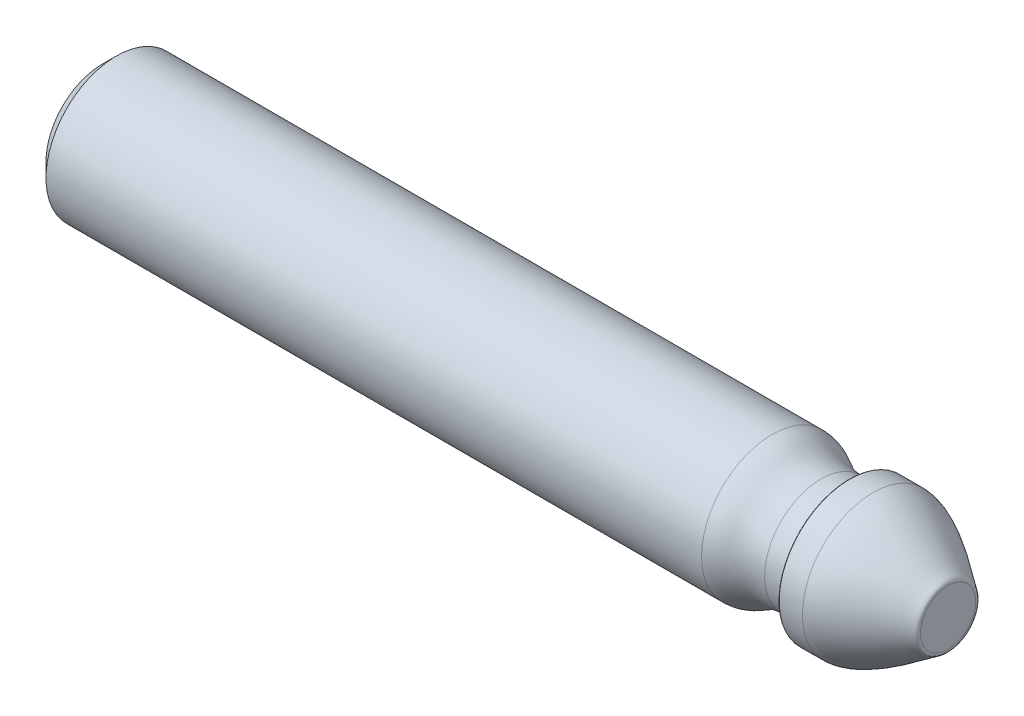
from build123d import *

# Parameters (mm, degrees)
EXTRUDE1_DEPTH      = 19.05
EXTRUDE1_DEPTH_BACK = 19.05
SKETCH2_R           = 3.175
CHAMFER1_SIZE       = 0.635
FILLET1_R           = 0.0254


with BuildPart() as part:
    # Sketch2 → Extrude1 (new, two sides: drawn at the far end of the back side and taken through both)
    with BuildSketch(Plane(origin=(0, 0, 0), x_dir=(0, 0, -1), z_dir=(1, 0, 0)).offset(-EXTRUDE1_DEPTH_BACK)):
        Circle(SKETCH2_R)
    extrude(amount=EXTRUDE1_DEPTH + EXTRUDE1_DEPTH_BACK)

    # Chamfer1
    chamfer1_edges = [part.edges().sort_by_distance(p)[0] for p in [
        (-19.05, 0, 3.175),
        (19.05, 0, 3.175),
    ]]
    chamfer(chamfer1_edges, length=CHAMFER1_SIZE)

    # Sketch3 → Cut-Revolve1 (revolve, cut)
    with BuildSketch(Plane.XY, mode=Mode.PRIVATE) as cut_revolve1_sk:
        with BuildLine():
            Line((14.593409285, 2.54), (14.593409285, 3.175))
            Line((14.593409285, 3.175), (11.118656598, 3.175))
            add(Edge.make_bspline(
                [(11.118656598, 3.175), (11.987913735, 3.175), (12.0733688, 2.54), (13.323409285, 2.54)],
                knots=[0, 0, 0, 0, 1, 1, 1, 1], degree=3))
            Line((13.323409285, 2.54), (14.593409285, 2.54))
        make_face()
        with BuildLine():
            Line((19.05, 3.175), (15.662226672, 3.175))
            add(Edge.make_bspline(
                [(15.662226672, 3.175), (16.642763194, 3.175), (18.613991134, 1.631073428), (19.044096366, 1.382495278), (19.05, 1.348727309), (19.05, 1.243390408)],
                knots=[0, 0, 0, 0, 0.565725481, 0.665725481, 1, 1, 1, 1], degree=3))
            Line((19.05, 1.243390408), (19.05, 3.175))
        make_face()
    revolve(cut_revolve1_sk.sketch.rotate(Axis((-19.05, 0, 0), (1, 0, 0)), 90), axis=Axis((-19.05, 0, 0), (1, 0, 0)), mode=Mode.SUBTRACT)

    # Fillet1
    fillet1_edges = [part.edges().sort_by_distance(p)[0] for p in [
        (14.593409285, 0, 3.175),
    ]]
    fillet(fillet1_edges, radius=FILLET1_R)


solid = part.part
